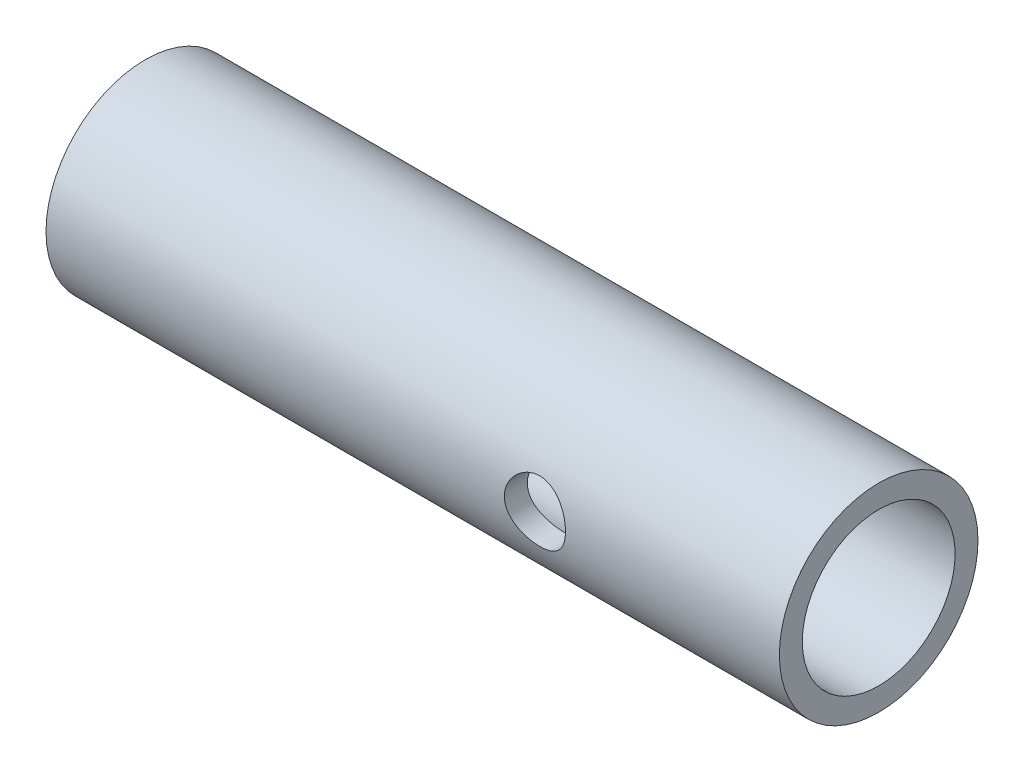
from build123d import *

# Parameters (mm, degrees)
SKETCH1_W               = 152.4
SKETCH1_H               = 4.7625
CUT_EXTRUDE1_DEPTH      = 156.169497043
CUT_EXTRUDE1_DEPTH_BACK = 156.169497043
SKETCH2_R               = 6.35


with BuildPart() as part:
    # Sketch1 → Revolve1 (revolve)
    with BuildSketch(Plane.XY, mode=Mode.PRIVATE) as revolve1_sk:
        with Locations((76.2, 18.25625)):
            Rectangle(SKETCH1_W, SKETCH1_H)
    revolve(revolve1_sk.sketch.rotate(Axis((0, 0, 0), (1, 0, 0)), 90), axis=Axis((0, 0, 0), (1, 0, 0)))

    # Sketch2 → Cut-Extrude1 (cut, two sides: drawn at the far end of the back side and taken through both)
    with BuildSketch(Plane.XY.offset(-CUT_EXTRUDE1_DEPTH_BACK)):
        with Locations((101.6, 0)):
            Circle(SKETCH2_R)
    extrude(amount=CUT_EXTRUDE1_DEPTH + CUT_EXTRUDE1_DEPTH_BACK, mode=Mode.SUBTRACT)


solid = part.part
